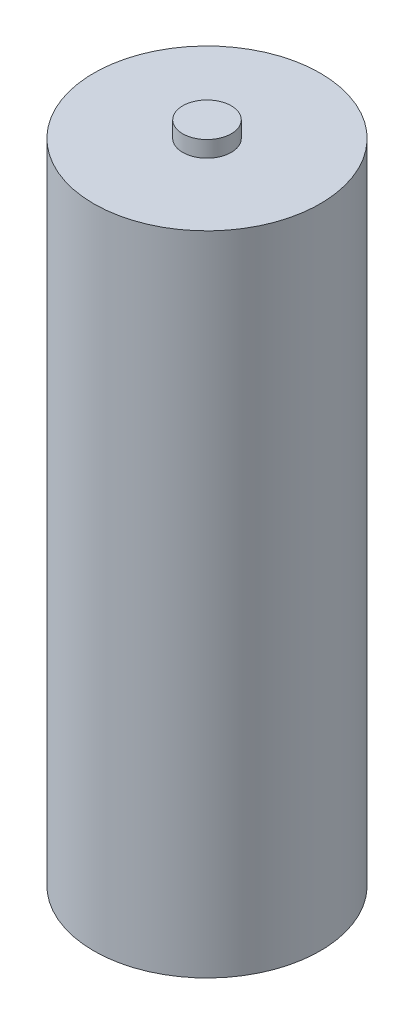
from build123d import *

# Parameters (mm, degrees)
SKETCH1_R           = 7
BOSS_EXTRUDE1_DEPTH = 40
SKETCH2_R           = 1.5
BOSS_EXTRUDE2_DEPTH = 1


with BuildPart() as part:
    # Sketch1 → Boss-Extrude1 (new body)
    with BuildSketch(Plane(origin=(0, 0, 0), x_dir=(1, 0, 0), z_dir=(0, 1, 0))):
        with Locations(Location((0, 0, 0), (0, 0, 270))):
            Circle(SKETCH1_R)
    extrude(amount=BOSS_EXTRUDE1_DEPTH)

    # Sketch2 → Boss-Extrude2 (add)
    with BuildSketch(Plane(origin=(0, 40, 0), x_dir=(1, 0, 0), z_dir=(0, 1, 0))):
        with Locations(Location((0, 0, 0), (0, 0, 270))):
            Circle(SKETCH2_R)
    extrude(amount=BOSS_EXTRUDE2_DEPTH)


solid = part.part
